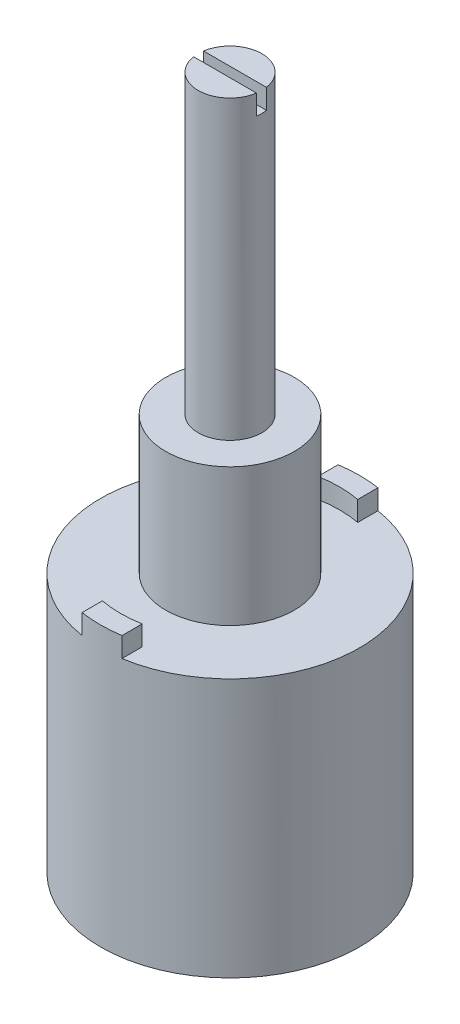
from build123d import *

# Parameters (mm, degrees)
SKETCH1_R           = 6.5
BOSS_EXTRUDE1_DEPTH = 13
SKETCH2_R           = 3.225
BOSS_EXTRUDE2_DEPTH = 6.9
SKETCH3_R           = 1.6
BOSS_EXTRUDE3_DEPTH = 14.88
BOSS_EXTRUDE4_DEPTH = 1
CUT_EXTRUDE1_START  = -1
CUT_EXTRUDE1_DEPTH  = 1


with BuildPart() as part:
    # Sketch1 → Boss-Extrude1 (new body)
    with BuildSketch(Plane(origin=(0, 0, 0), x_dir=(1, 0, 0), z_dir=(0, 1, 0))):
        with Locations(Location((0, 0, 0), (0, 0, 90))):
            Circle(SKETCH1_R)
    extrude(amount=BOSS_EXTRUDE1_DEPTH)

    # Sketch2 → Boss-Extrude2 (add)
    with BuildSketch(Plane(origin=(0, 13, 0), x_dir=(1, 0, 0), z_dir=(0, 1, 0))):
        with Locations(Location((0, 0, 0), (0, 0, 90))):
            Circle(SKETCH2_R)
    extrude(amount=BOSS_EXTRUDE2_DEPTH)

    # Sketch3 → Boss-Extrude3 (add)
    with BuildSketch(Plane(origin=(0, 19.9, 0), x_dir=(1, 0, 0), z_dir=(0, 1, 0))):
        with Locations(Location((0, 0, 0), (0, 0, 270))):
            Circle(SKETCH3_R)
    extrude(amount=BOSS_EXTRUDE3_DEPTH)

    # Sketch4 → Boss-Extrude4 (add)
    with BuildSketch(Plane(origin=(0, 13, 0), x_dir=(1, 0, 0), z_dir=(0, 1, 0))):
        with BuildLine():
            ThreePointArc((-1, 5.408326913), (-0.502096593, 5.477033779), (0, 5.5))
            ThreePointArc((0, 5.5), (0.502096593, 5.477033779), (1, 5.408326913))
            Line((1, 5.408326913), (1, 5.5))
            Line((1, 5.5), (1, 6.422616289))
            ThreePointArc((1, 6.422616289), (0, 6.5), (-1, 6.422616289))
            Line((-1, 6.422616289), (-1, 5.5))
            Line((-1, 5.5), (-1, 5.408326913))
        make_face()
        with BuildLine():
            ThreePointArc((1, -5.408326913), (0.502096593, -5.477033779), (0, -5.5))
            ThreePointArc((0, -5.5), (-0.502096593, -5.477033779), (-1, -5.408326913))
            Line((-1, -5.408326913), (-1, -5.5))
            Line((-1, -5.5), (-1, -6.422616289))
            ThreePointArc((-1, -6.422616289), (0, -6.5), (1, -6.422616289))
            Line((1, -6.422616289), (1, -5.5))
            Line((1, -5.5), (1, -5.408326913))
        make_face()
    extrude(amount=BOSS_EXTRUDE4_DEPTH)

    # Sketch5 → Cut-Extrude1 (cut)
    with BuildSketch(Plane(origin=(0, 34.78, 0), x_dir=(1, 0, 0), z_dir=(0, 1, 0)).offset(CUT_EXTRUDE1_START)):
        with BuildLine():
            Line((-1.6, 0), (1.6, 0))
            ThreePointArc((1.6, 0), (1.59507945, 0.125385604), (1.580348063, 0.25))
            Line((1.580348063, 0.25), (-1.580348063, 0.25))
            ThreePointArc((-1.580348063, 0.25), (-1.59507945, 0.125385604), (-1.6, 0))
        make_face()
        with BuildLine():
            ThreePointArc((1.580348063, -0.25), (1.59507945, -0.125385604), (1.6, 0))
            Line((1.6, 0), (-1.6, 0))
            ThreePointArc((-1.6, 0), (-1.59507945, -0.125385604), (-1.580348063, -0.25))
            Line((-1.580348063, -0.25), (1.580348063, -0.25))
        make_face()
    extrude(amount=CUT_EXTRUDE1_DEPTH, mode=Mode.SUBTRACT)


solid = part.part
